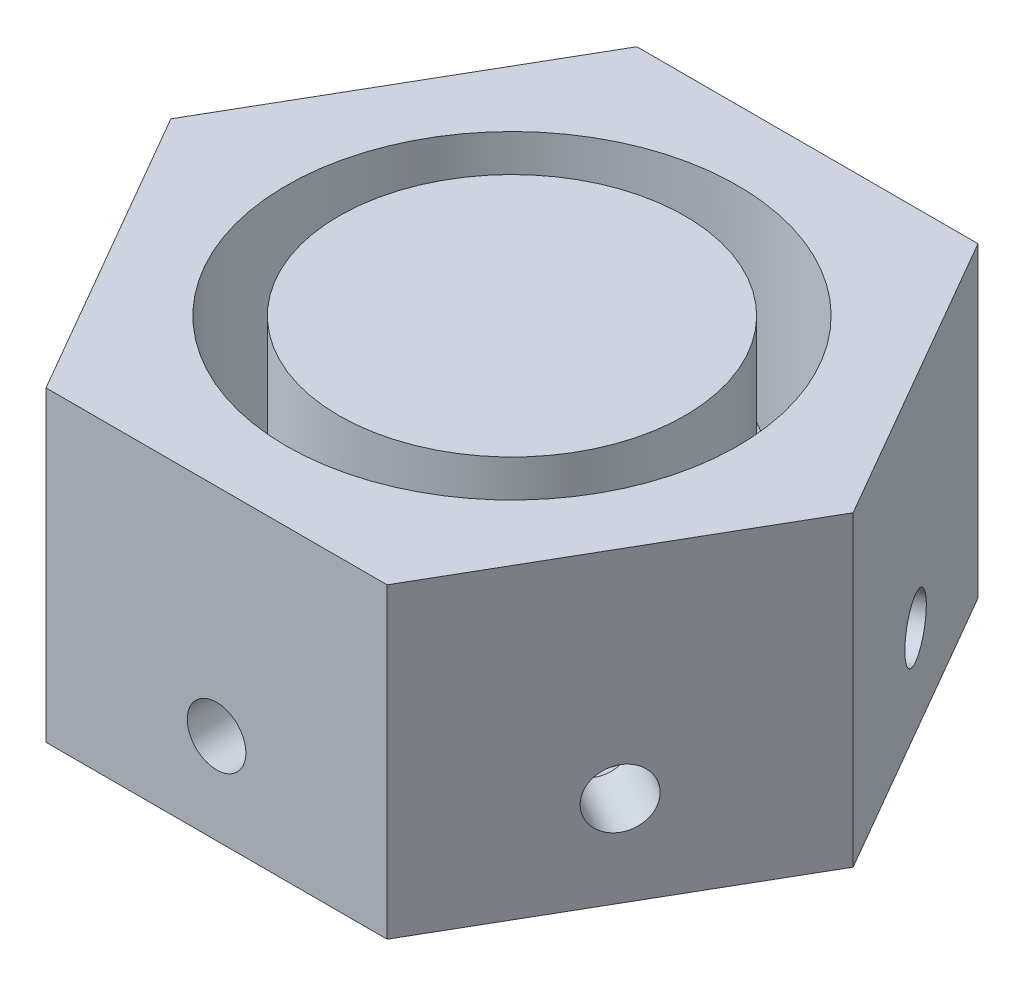
from build123d import *

# Parameters (mm, degrees)
BOSS_EXTRUDE1_DEPTH = 2
SKETCH1_3_R         = 16.175
SKETCH1_3_R_2       = 12.4
BOSS_EXTRUDE2_DEPTH = 20
SKETCH2_R           = 2.1
CUT_EXTRUDE1_DEPTH  = 39.029218482
CIRPATTERN1_COUNT   = 6


with BuildPart() as part:
    # Sketch1 → Boss-Extrude1 (new body)
    with BuildSketch(Plane(origin=(0, 0, 0), x_dir=(1, 0, 0), z_dir=(0, 1, 0))):
        Polygon((12.22539195, -21.175), (24.4507839, 0), (12.22539195, 21.175), (-12.22539195, 21.175), (-24.4507839, 0), (-12.22539195, -21.175), align=None)
    extrude(amount=-BOSS_EXTRUDE1_DEPTH)

    # Sketch1<3> → Boss-Extrude2 (add)
    # profile 1 of 2: a face of its own
    with BuildSketch(Plane(origin=(0, 0, 0), x_dir=(1, 0, 0), z_dir=(0, 1, 0))):
        Polygon((12.22539195, -21.175), (24.4507839, 0), (12.22539195, 21.175), (-12.22539195, 21.175), (-24.4507839, 0), (-12.22539195, -21.175), align=None)
        Circle(SKETCH1_3_R, mode=Mode.SUBTRACT)
    # profile 2 of 2: a face of its own
    with BuildSketch(Plane(origin=(0, 0, 0), x_dir=(1, 0, 0), z_dir=(0, 1, 0))):
        Circle(SKETCH1_3_R_2)
    extrude(amount=BOSS_EXTRUDE2_DEPTH)

    # Sketch2 → Cut-Extrude1 (cut, through all)
    with BuildSketch(Plane.XY):
        with Locations((0, 4.5)):
            Circle(SKETCH2_R)
    cut_extrude1 = extrude(amount=-CUT_EXTRUDE1_DEPTH, mode=Mode.SUBTRACT)

    # CirPattern1: Cut-Extrude1 ×6 about axis
    cirpattern1_axis = Axis((0, 20, 0), (0, -1, 0))
    for i in range(1, CIRPATTERN1_COUNT):
        add(cut_extrude1.rotate(cirpattern1_axis, i * 360 / CIRPATTERN1_COUNT), mode=Mode.SUBTRACT)


solid = part.part
